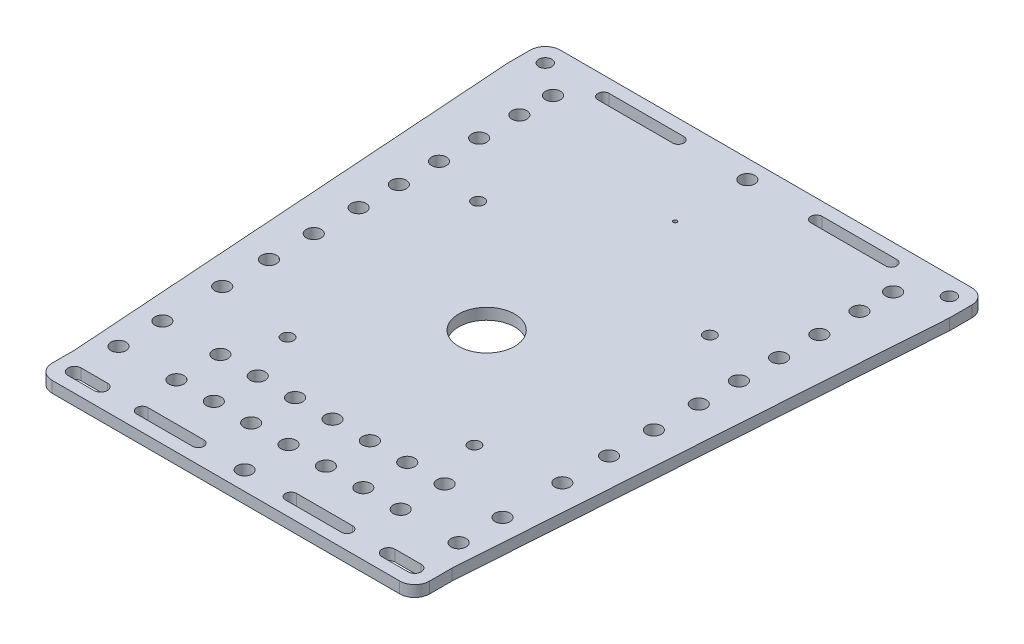
from build123d import *

# Parameters (mm, degrees)
SKETCH1_R           = 1.75
BOSS_EXTRUDE2_DEPTH = 3
SKETCH2_R           = 1.6
CUT_EXTRUDE1_DEPTH  = 3
FILLET1_R           = 4
SKETCH3_R           = 2
CUT_EXTRUDE2_DEPTH  = 3
SKETCH4_R           = 2
CUT_EXTRUDE3_DEPTH  = 3
SKETCH7_R           = 7.5
CUT_EXTRUDE5_DEPTH  = 3
SKETCH8_R           = 2
CUT_EXTRUDE7_DEPTH  = 3
SKETCH9_R           = 0.5
CUT_EXTRUDE8_DEPTH  = 3


with BuildPart() as part:
    # Sketch1 → Boss-Extrude2 (new body)
    with BuildSketch(Plane(origin=(0, 0, 0), x_dir=(1, 0, 0), z_dir=(0, 1, 0))):
        Polygon((-17.06639584, -5), (-8.5, -129.5), (-8.5, -134.5), (-8.5, -139.5), (92.5, -139.5), (92.5, -129.5), (101.06639584, -5), (101.06639584, 5), (96.06639584, 5), (-17.06639584, 5), (-17.06639584, 0), align=None)
        with Locations(Location((-12.06639584, 0, 0), (0, 0, 270))):
            Circle(SKETCH1_R, mode=Mode.SUBTRACT)
        with Locations(Location((96.06639584, 0, 0), (0, 0, 270))):
            Circle(SKETCH1_R, mode=Mode.SUBTRACT)
        with BuildLine():
            Line((-3.5, -132.75), (3.5, -132.75))
            ThreePointArc((3.5, -132.75), (5.25, -134.5), (3.5, -136.25))
            Line((3.5, -136.25), (-3.5, -136.25))
            ThreePointArc((-3.5, -136.25), (-5.25, -134.5), (-3.5, -132.75))
        make_face(mode=Mode.SUBTRACT)
        with BuildLine():
            Line((87.5, -132.75), (80.5, -132.75))
            ThreePointArc((80.5, -132.75), (78.75, -134.5), (80.5, -136.25))
            Line((80.5, -136.25), (87.5, -136.25))
            ThreePointArc((87.5, -136.25), (89.25, -134.5), (87.5, -132.75))
        make_face(mode=Mode.SUBTRACT)
    extrude(amount=BOSS_EXTRUDE2_DEPTH)

    # Sketch2 → Cut-Extrude1 (cut)
    with BuildSketch(Plane(origin=(0, 3, 0), x_dir=(1, 0, 0), z_dir=(0, 1, 0))):
        with Locations(Location((11, -41.028359395, 0), (0, 0, 270))):
            Circle(SKETCH2_R)
        with Locations(Location((73, -41.028359395, 0), (0, 0, 270))):
            Circle(SKETCH2_R)
        with Locations(Location((17, -98.028359395, 0), (0, 0, 270))):
            Circle(SKETCH2_R)
        with Locations(Location((67, -98.028359395, 0), (0, 0, 270))):
            Circle(SKETCH2_R)
    extrude(amount=-CUT_EXTRUDE1_DEPTH, mode=Mode.SUBTRACT)

    # Fillet1
    fillet1_edges = [part.edges().sort_by_distance(p)[0] for p in [
        (-17.06639584, 1.5, -5),
        (101.06639584, 1.5, -5),
        (92.5, 1.5, 139.5),
        (-8.5, 1.5, 139.5),
    ]]
    fillet(fillet1_edges, radius=FILLET1_R)

    # Sketch3 → Cut-Extrude2 (cut)
    with BuildSketch(Plane(origin=(0, 3, 0), x_dir=(1, 0, 0), z_dir=(0, 1, 0))):
        with Locations(Location((42, 0, 0), (0, 0, 270))):
            Circle(SKETCH3_R)
        with Locations(Location((-3.5, -95, 0), (0, 0, 270))):
            Circle(SKETCH3_R)
        with Locations(Location((-3.5, -111, 0), (0, 0, 270))):
            Circle(SKETCH3_R)
        with Locations(Location((42, -134.5, 0), (0, 0, 270))):
            Circle(SKETCH3_R)
        with Locations(Location((-3.5, -122.75, 0), (0, 0, 270))):
            Circle(SKETCH3_R)
        with Locations(Location((12, -111, 0), (0, 0, 270))):
            Circle(SKETCH3_R)
        with Locations(Location((22, -111, 0), (0, 0, 270))):
            Circle(SKETCH3_R)
        with Locations(Location((32, -111, 0), (0, 0, 270))):
            Circle(SKETCH3_R)
        with Locations(Location((42, -111, 0), (0, 0, 270))):
            Circle(SKETCH3_R)
        with Locations(Location((52, -111, 0), (0, 0, 90))):
            Circle(SKETCH3_R)
        with Locations(Location((62, -111, 0), (0, 0, 90))):
            Circle(SKETCH3_R)
        with Locations(Location((72, -111, 0), (0, 0, 90))):
            Circle(SKETCH3_R)
        with Locations(Location((87.5, -122.75, 0), (0, 0, 90))):
            Circle(SKETCH3_R)
        with Locations(Location((87.5, -111, 0), (0, 0, 90))):
            Circle(SKETCH3_R)
        with Locations(Location((87.5, -95, 0), (0, 0, 90))):
            Circle(SKETCH3_R)
        with BuildLine():
            Line((23.519670138, -1.5), (3.519670138, -1.5))
            ThreePointArc((3.519670138, -1.5), (2.019670138, 0), (3.519670138, 1.5))
            Line((3.519670138, 1.5), (23.519670138, 1.5))
            ThreePointArc((23.519670138, 1.5), (25.019670138, 0), (23.519670138, -1.5))
        make_face()
        with BuildLine():
            Line((29.602369227, -136), (14.602369227, -136))
            ThreePointArc((14.602369227, -136), (13.102369227, -134.5), (14.602369227, -133))
            Line((14.602369227, -133), (29.602369227, -133))
            ThreePointArc((29.602369227, -133), (31.102369227, -134.5), (29.602369227, -136))
        make_face()
        with BuildLine():
            Line((54.397630773, -136), (69.397630773, -136))
            ThreePointArc((69.397630773, -136), (70.897630773, -134.5), (69.397630773, -133))
            Line((69.397630773, -133), (54.397630773, -133))
            ThreePointArc((54.397630773, -133), (52.897630773, -134.5), (54.397630773, -136))
        make_face()
        with BuildLine():
            Line((60.480329862, -1.5), (80.480329862, -1.5))
            ThreePointArc((80.480329862, -1.5), (81.980329862, 0), (80.480329862, 1.5))
            Line((80.480329862, 1.5), (60.480329862, 1.5))
            ThreePointArc((60.480329862, 1.5), (58.980329862, 0), (60.480329862, -1.5))
        make_face()
    extrude(amount=-CUT_EXTRUDE2_DEPTH, mode=Mode.SUBTRACT)

    # Sketch4 → Cut-Extrude3 (cut)
    with BuildSketch(Plane(origin=(0, 3, 0), x_dir=(1, 0, 0), z_dir=(0, 1, 0))):
        with Locations(Location((12, -122.75, 0), (0, 0, 270))):
            Circle(SKETCH4_R)
        with Locations(Location((22, -122.75, 0), (0, 0, 270))):
            Circle(SKETCH4_R)
        with Locations(Location((32, -122.75, 0), (0, 0, 270))):
            Circle(SKETCH4_R)
        with Locations(Location((42, -122.75, 0), (0, 0, 270))):
            Circle(SKETCH4_R)
        with Locations(Location((52, -122.75, 0), (0, 0, 270))):
            Circle(SKETCH4_R)
        with Locations(Location((62, -122.75, 0), (0, 0, 270))):
            Circle(SKETCH4_R)
        with Locations(Location((72, -122.75, 0), (0, 0, 270))):
            Circle(SKETCH4_R)
    extrude(amount=-CUT_EXTRUDE3_DEPTH, mode=Mode.SUBTRACT)

    # Sketch7 → Cut-Extrude5 (cut)
    with BuildSketch(Plane(origin=(0, 3, 0), x_dir=(1, 0, 0), z_dir=(0, 1, 0))):
        with Locations(Location((42, -69.75, 0), (0, 0, 270))):
            Circle(SKETCH7_R)
    extrude(amount=-CUT_EXTRUDE5_DEPTH, mode=Mode.SUBTRACT)

    # Sketch8 → Cut-Extrude7 (cut)
    with BuildSketch(Plane(origin=(0, 3, 0), x_dir=(1, 0, 0), z_dir=(0, 1, 0))):
        with Locations(Location((-3.5, -26.25, 0), (0, 0, 270))):
            Circle(SKETCH8_R)
        with Locations(Location((-3.5, -37, 0), (0, 0, 270))):
            Circle(SKETCH8_R)
        with Locations(Location((-3.5, -70.5, 0), (0, 0, 270))):
            Circle(SKETCH8_R)
        with Locations(Location((-3.5, -82.5, 0), (0, 0, 270))):
            Circle(SKETCH8_R)
        with Locations(Location((-3.5, -6.5, 0), (0, 0, 270))):
            Circle(SKETCH8_R)
        with Locations(Location((-3.5, -15.5, 0), (0, 0, 270))):
            Circle(SKETCH8_R)
        with Locations(Location((-3.5, -47.75, 0), (0, 0, 270))):
            Circle(SKETCH8_R)
        with Locations(Location((-3.5, -58.5, 0), (0, 0, 270))):
            Circle(SKETCH8_R)
        with Locations(Location((87.5, -6.5, 0), (0, 0, 90))):
            Circle(SKETCH8_R)
        with Locations(Location((87.5, -15.5, 0), (0, 0, 90))):
            Circle(SKETCH8_R)
        with Locations(Location((87.5, -26.25, 0), (0, 0, 90))):
            Circle(SKETCH8_R)
        with Locations(Location((87.5, -37, 0), (0, 0, 90))):
            Circle(SKETCH8_R)
        with Locations(Location((87.5, -47.75, 0), (0, 0, 90))):
            Circle(SKETCH8_R)
        with Locations(Location((87.5, -58.5, 0), (0, 0, 90))):
            Circle(SKETCH8_R)
        with Locations(Location((87.5, -70.5, 0), (0, 0, 90))):
            Circle(SKETCH8_R)
        with Locations(Location((87.5, -82.5, 0), (0, 0, 90))):
            Circle(SKETCH8_R)
    extrude(amount=-CUT_EXTRUDE7_DEPTH, mode=Mode.SUBTRACT)

    # Sketch9 → Cut-Extrude8 (cut)
    with BuildSketch(Plane(origin=(0, 3, 0), x_dir=(1, 0, 0), z_dir=(0, 1, 0))):
        with Locations(Location((42, -19.310550248, 0), (0, 0, 270))):
            Circle(SKETCH9_R)
    extrude(amount=-CUT_EXTRUDE8_DEPTH, mode=Mode.SUBTRACT)


solid = part.part
